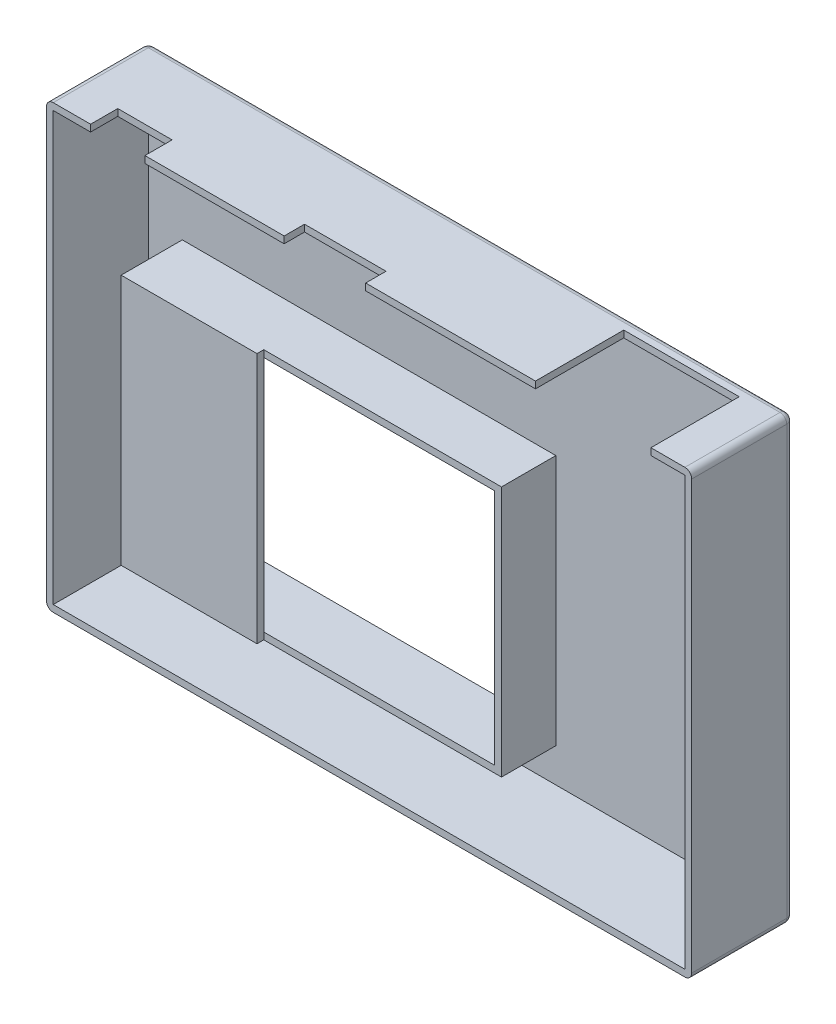
from build123d import *

# Parameters (mm, degrees)
SKETCH_1_W             = 95
SKETCH_1_H             = 65
EXTRUDE_220_DEPTH      = 15
SKETCH_2_W             = 93
SKETCH_2_H             = 63
CUT_EXTRUDE_347_DEPTH  = 14
SKETCH_3_W             = 17
SKETCH_3_H             = 1
ETHERNET_DEPTH         = 13
FILLET_1_R             = 1
FILLET_2_R             = 1
FILLET_3_R             = 1
FILLET_4_R             = 1
SKETCH_4_W             = 8
SKETCH_4_H             = 1
USB_DEPTH              = 4
SKETCH_5_W             = 12
SKETCH_5_H             = 1
MICROSD_DEPTH          = 3
SKETCH_7_W             = 55
SKETCH_7_H             = 37
EXTRUDE_1830_DEPTH     = 10
SKETCH_6_W             = 53
SKETCH_6_H             = 35
CUT_EXTRUDE_1960_DEPTH = 9
SKETCH_8_W             = 35
SKETCH_8_H             = 37
CUT_EXTRUDE_8_DEPTH    = 1


with BuildPart() as part:
    # Эскиз1 → Extrude 220 (new body)
    with BuildSketch(Plane.XY):
        with Locations((47.5, 32.5)):
            Rectangle(SKETCH_1_W, SKETCH_1_H)
    extrude(amount=EXTRUDE_220_DEPTH)

    # Эскиз2 → Cut-Extrude 347 (cut)
    with BuildSketch(Plane.XY.offset(15)):
        with Locations((47.5, 32.5)):
            Rectangle(SKETCH_2_W, SKETCH_2_H)
    extrude(amount=-CUT_EXTRUDE_347_DEPTH, mode=Mode.SUBTRACT)

    # Эскиз3 → Ethernet (cut)
    with BuildSketch(Plane.XY.offset(15)):
        with Locations((80.5, 64.5)):
            Rectangle(SKETCH_3_W, SKETCH_3_H)
    extrude(amount=-ETHERNET_DEPTH, mode=Mode.SUBTRACT)

    # Скругление1
    fillet_1_edges = [part.edges().sort_by_distance(p)[0] for p in [
        (47.5, 65, 0),
    ]]
    fillet(fillet_1_edges, radius=FILLET_1_R)

    # Скругление2
    fillet_2_edges = [part.edges().sort_by_distance(p)[0] for p in [
        (0, 32, 0),
        (0, 64.707106781, 0.292893219),
        (0, 65, 8),
    ]]
    fillet(fillet_2_edges, radius=FILLET_2_R)

    # Скругление3
    fillet_3_edges = [part.edges().sort_by_distance(p)[0] for p in [
        (48, 0, 0),
        (0.292893219, 0, 0.292893219),
        (0, 0, 8),
    ]]
    fillet(fillet_3_edges, radius=FILLET_3_R)

    # Скругление4
    fillet_4_edges = [part.edges().sort_by_distance(p)[0] for p in [
        (95, 64.707106781, 0.292893219),
        (95, 32.5, 0),
        (95, 0.292893219, 0.292893219),
        (95, 65, 8),
        (95, 0, 8),
    ]]
    fillet(fillet_4_edges, radius=FILLET_4_R)

    # Эскиз4 → USB (cut)
    with BuildSketch(Plane.XY.offset(15)):
        with Locations((10.5, 64.5)):
            Rectangle(SKETCH_4_W, SKETCH_4_H)
    extrude(amount=-USB_DEPTH, mode=Mode.SUBTRACT)

    # Эскиз5 → MicroSD (cut)
    with BuildSketch(Plane.XY.offset(15)):
        with Locations((41, 64.5)):
            Rectangle(SKETCH_5_W, SKETCH_5_H)
    extrude(amount=-MICROSD_DEPTH, mode=Mode.SUBTRACT)

    # Эскиз7 → Extrude 1830 (add)
    with BuildSketch(Plane(origin=(0, 0, 0), x_dir=(-1, 0, 0), z_dir=(0, 0, -1))):
        with Locations((-33.5, 24.5)):
            Rectangle(SKETCH_7_W, SKETCH_7_H)
    extrude(amount=-EXTRUDE_1830_DEPTH)

    # Эскиз6 → Cut-Extrude 1960 (cut)
    with BuildSketch(Plane(origin=(0, 0, 0), x_dir=(-1, 0, 0), z_dir=(0, 0, -1))):
        with Locations((-33.5, 24.5)):
            Rectangle(SKETCH_6_W, SKETCH_6_H)
    extrude(amount=-CUT_EXTRUDE_1960_DEPTH, mode=Mode.SUBTRACT)

    # Эскиз8 → Вытянуть8 (cut)
    with BuildSketch(Plane.XY.offset(10)):
        with Locations((43.5, 24.5)):
            Rectangle(SKETCH_8_W, SKETCH_8_H)
    extrude(amount=-CUT_EXTRUDE_8_DEPTH, mode=Mode.SUBTRACT)


solid = part.part
